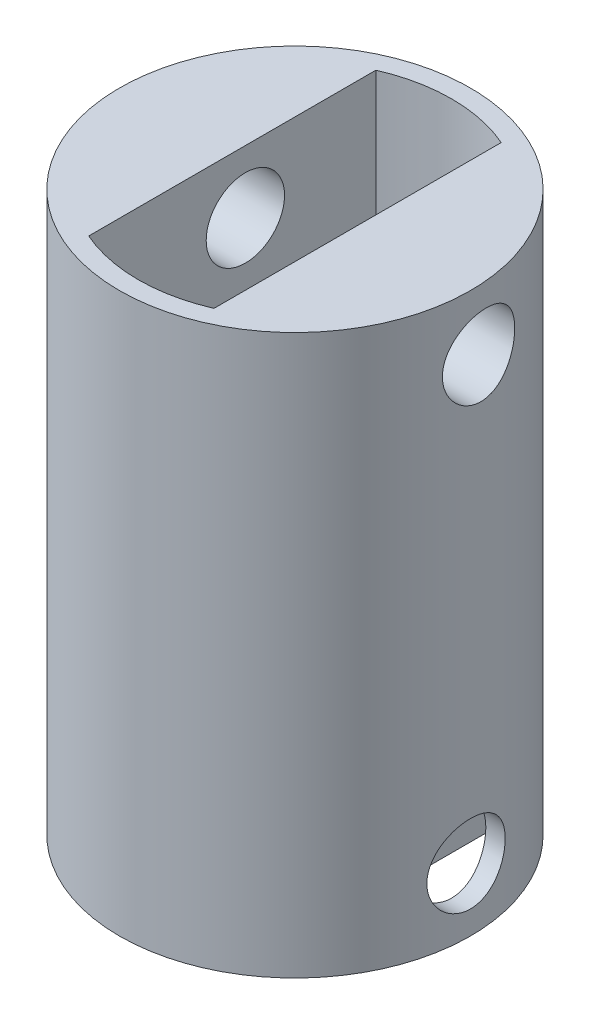
from build123d import *

# Parameters (mm, degrees)
SKETCH1_R               = 14.224
BOSS_EXTRUDE1_DEPTH     = 45.3136
CUT_EXTRUDE1_DEPTH      = 10.16
CUT_EXTRUDE2_START      = -10.16
CUT_EXTRUDE2_DEPTH      = 10.16
CUT_EXTRUDE3_DEPTH      = 52.266840521
CUT_EXTRUDE3_DEPTH_BACK = 52.266840521
SKETCH4_R               = 3.175
SKETCH5_R               = 2.54
CUT_EXTRUDE4_DEPTH      = 41.502098192


with BuildPart() as part:
    # Sketch1 → Boss-Extrude1 (new body)
    with BuildSketch(Plane(origin=(0, 0, 0), x_dir=(1, 0, 0), z_dir=(0, 1, 0))):
        with Locations(Location((0, 0, 0), (0, 0, 90))):
            Circle(SKETCH1_R)
    extrude(amount=BOSS_EXTRUDE1_DEPTH)

    # Sketch2 → Cut-Extrude1 (cut)
    with BuildSketch(Plane(origin=(0, 45.3136, 0), x_dir=(1, 0, 0), z_dir=(0, 1, 0))):
        with BuildLine():
            Line((5.08, 11.639742265), (5.08, -11.639742265))
            ThreePointArc((5.08, -11.639742265), (0, -12.7), (-5.08, -11.639742265))
            Line((-5.08, -11.639742265), (-5.08, 11.639742265))
            ThreePointArc((-5.08, 11.639742265), (0, 12.7), (5.08, 11.639742265))
        make_face()
    extrude(amount=-CUT_EXTRUDE1_DEPTH, mode=Mode.SUBTRACT)

    # Sketch3 → Cut-Extrude2 (cut)
    with BuildSketch(Plane.XZ.offset(CUT_EXTRUDE2_START)):
        with BuildLine():
            Line((-2.54, 12.443407893), (-2.54, -12.443407893))
            ThreePointArc((-2.54, -12.443407893), (0, -12.7), (2.54, -12.443407893))
            Line((2.54, -12.443407893), (2.54, 12.443407893))
            ThreePointArc((2.54, 12.443407893), (0, 12.7), (-2.54, 12.443407893))
        make_face()
        with BuildLine():
            Line((-7.62, 10.16), (-7.62, -10.16))
            ThreePointArc((-7.62, -10.16), (-12.7, 0), (-7.62, 10.16))
        make_face()
        with BuildLine():
            Line((7.62, 10.16), (7.62, -10.16))
            ThreePointArc((7.62, -10.16), (12.7, 0), (7.62, 10.16))
        make_face()
    extrude(amount=CUT_EXTRUDE2_DEPTH, mode=Mode.SUBTRACT)

    # Sketch4 → Cut-Extrude3 (cut, two sides: drawn at the far end of the back side and taken through both)
    with BuildSketch(Plane(origin=(-5.08, 0, 0), x_dir=(0, 0, -1), z_dir=(1, 0, 0)).offset(-CUT_EXTRUDE3_DEPTH_BACK)):
        with Locations((1.060257735, 40.2336)):
            Circle(SKETCH4_R)
        with Locations((0, 5.08)):
            Circle(SKETCH4_R)
    extrude(amount=CUT_EXTRUDE3_DEPTH + CUT_EXTRUDE3_DEPTH_BACK, mode=Mode.SUBTRACT)

    # Sketch5 → Cut-Extrude4 (cut, through all)
    with BuildSketch(Plane(origin=(0, 35.1536, 0), x_dir=(1, 0, 0), z_dir=(0, 1, 0))):
        with Locations(Location((0, 0, 0), (0, 0, 270))):
            Circle(SKETCH5_R)
    extrude(amount=-CUT_EXTRUDE4_DEPTH, mode=Mode.SUBTRACT)


solid = part.part
